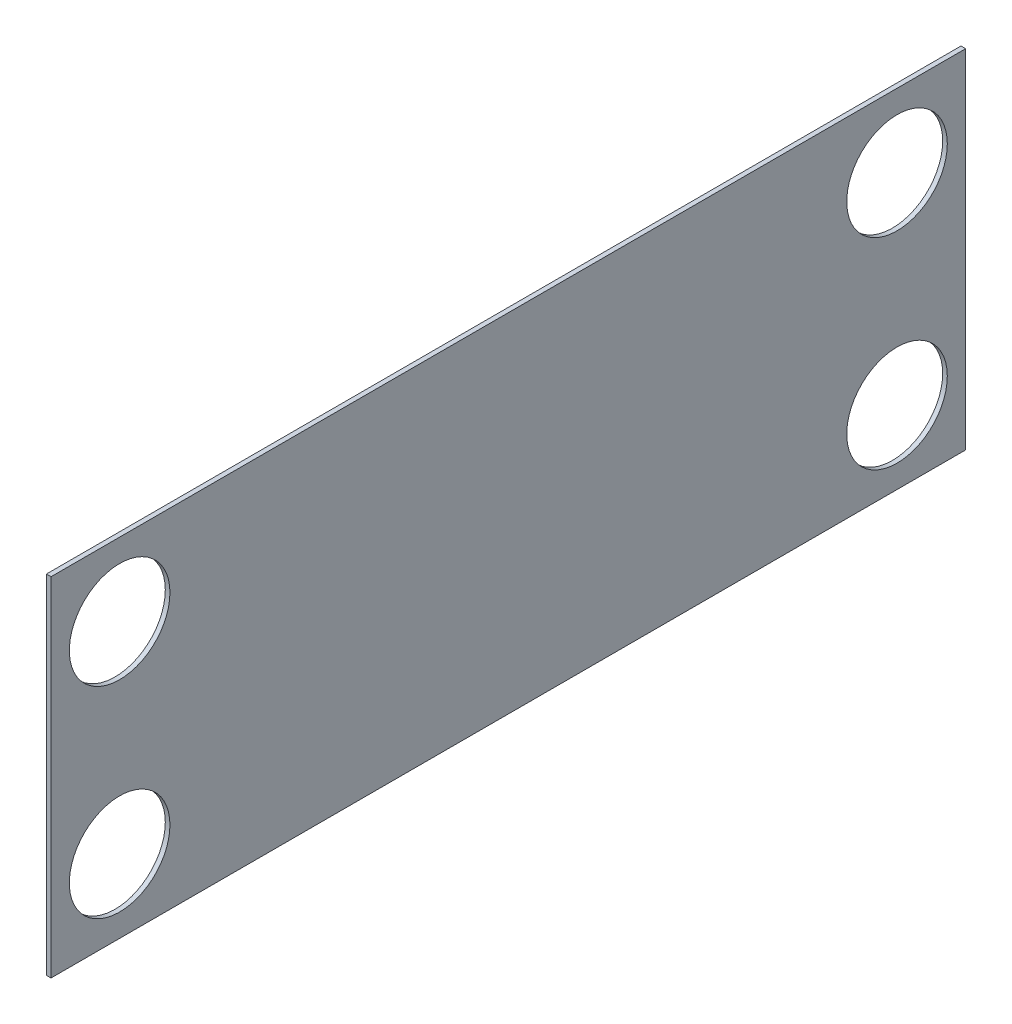
from build123d import *

# Parameters (mm, degrees)
SKETCH1_W             = 100
SKETCH1_H             = 38
BOSS_EXTRUDE1_DEPTH   = 0.508
M10_CLEARANCE_HOLE1_D = 11


with BuildPart() as part:
    # Sketch1 → Boss-Extrude1 (new body)
    with BuildSketch(Plane(origin=(0, 0, 0), x_dir=(0, 0, -1), z_dir=(1, 0, 0))):
        Rectangle(SKETCH1_W, SKETCH1_H)
    extrude(amount=BOSS_EXTRUDE1_DEPTH)

    # M10 Clearance Hole1 (through all)
    with Locations(Plane(origin=(0.508, 0, 0), x_dir=(0, 0, -1), z_dir=(1, 0, 0))):
        with Locations((-42.5, 11), (-42.5, -11), (42.5, 11), (42.5, -11)):
            Hole(M10_CLEARANCE_HOLE1_D / 2)


solid = part.part
